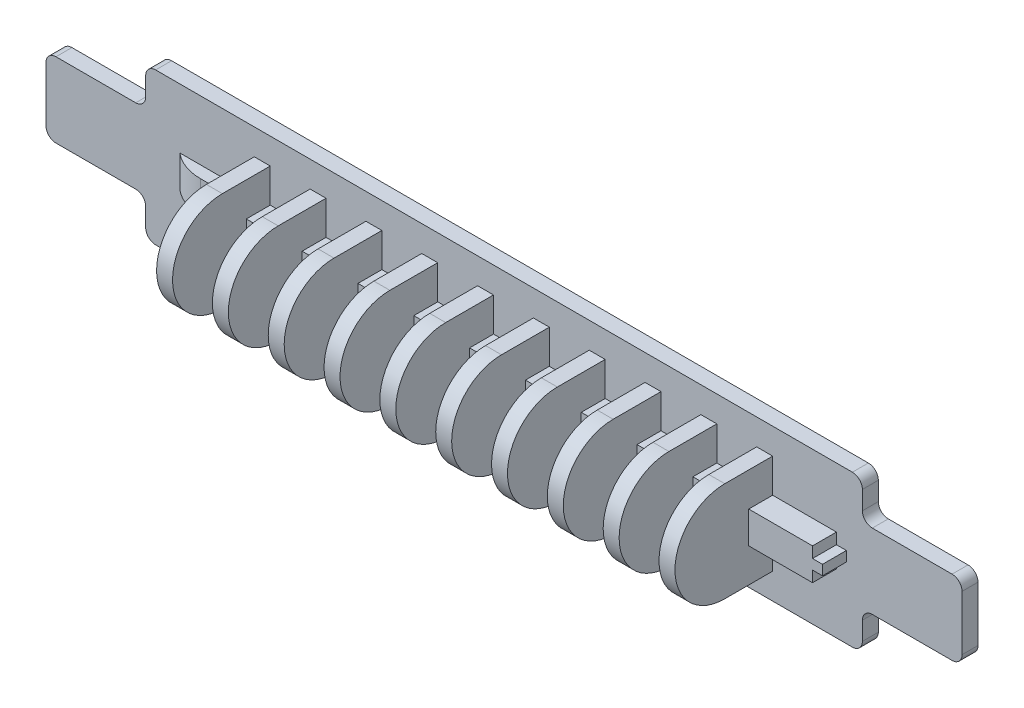
from build123d import *

# Parameters (mm, degrees)
SKETCH_1_W           = 89.86690944
SKETCH_1_H           = 19
EXTRUDE_1_DEPTH      = 2
SKETCH_2_W           = 2
SKETCH_2_H           = 12.5
EXTRUDE_2_DEPTH      = 6
EXTRUDE_3_DEPTH      = 3
SKETCH_4_W           = 2
SKETCH_4_H           = 6.25
REVOLVE_1_ANGLE      = 180
EXTRUDE_8_DEPTH      = 1.5
EXTRUDE_8_DEPTH_BACK = 3.5
SKETCH_11_W          = 9.25
SKETCH_11_H          = 3
SCALE_1_SCALE        = 1.6
CUT_EXTRUDE_START    = -2.4
SKETCH_13_W          = 14.8
SKETCH_13_H          = 4.8
CUT_EXTRUDE_3_DEPTH  = 2.4
SKETCH_16_W          = 2
SKETCH_16_H          = 2.2
CUT_EXTRUDE_5_DEPTH  = 4.8
EXTRUDE_START        = -3.190039
EXTRUDE_10_DEPTH     = 6.4
CUT_EXTRUDE_6_REACH  = 79.611
FILLET_1_R           = 2
SKETCH_19_W          = 20
SKETCH_19_H          = 15
EXTRUDE_11_DEPTH     = 3.2
FILLET_2_R           = 2


with BuildPart() as part:
    # 草图1 → 凸台-拉伸1 (new body)
    with BuildSketch(Plane.XY):
        Rectangle(SKETCH_1_W, SKETCH_1_H)
    extrude(amount=EXTRUDE_1_DEPTH)

    # 草图2 → 凸台-拉伸2 (add)
    with BuildSketch(Plane.XY.offset(2)):
        with Locations((32.68345472, 0)):
            Rectangle(SKETCH_2_W, SKETCH_2_H)
        with Locations((25.68345472, 0)):
            Rectangle(SKETCH_2_W, SKETCH_2_H)
        with Locations((18.68345472, 0)):
            Rectangle(SKETCH_2_W, SKETCH_2_H)
        with Locations((11.68345472, 0)):
            Rectangle(SKETCH_2_W, SKETCH_2_H)
        with Locations((4.68345472, 0)):
            Rectangle(SKETCH_2_W, SKETCH_2_H)
        with Locations((-2.31654528, 0)):
            Rectangle(SKETCH_2_W, SKETCH_2_H)
        with Locations((-9.31654528, 0)):
            Rectangle(SKETCH_2_W, SKETCH_2_H)
        with Locations((-16.31654528, 0)):
            Rectangle(SKETCH_2_W, SKETCH_2_H)
        with Locations((-23.31654528, 0)):
            Rectangle(SKETCH_2_W, SKETCH_2_H)
        with Locations((-30.31654528, 0)):
            Rectangle(SKETCH_2_W, SKETCH_2_H)
    extrude(amount=EXTRUDE_2_DEPTH)

    # 草图3 → 凸台-拉伸3 (add)
    with BuildSketch(Plane.XY.offset(2)):
        Polygon((-29.31654528, -2), (42.93345472, -2), (42.93345472, 2), (-36.31654528, 2), (-36.31654528, -2), align=None)
    extrude(amount=EXTRUDE_3_DEPTH)

    # 草图4 → 旋转1 (revolve)
    with BuildSketch(Plane.XY.offset(8)):
        with Locations((25.68345472, -3.125)):
            Rectangle(SKETCH_4_W, SKETCH_4_H)
        with Locations((32.68345472, -3.125)):
            Rectangle(SKETCH_4_W, SKETCH_4_H)
        with Locations((18.68345472, -3.125)):
            Rectangle(SKETCH_4_W, SKETCH_4_H)
        with Locations((11.68345472, -3.125)):
            Rectangle(SKETCH_4_W, SKETCH_4_H)
        with Locations((4.68345472, -3.125)):
            Rectangle(SKETCH_4_W, SKETCH_4_H)
        with Locations((-2.31654528, -3.125)):
            Rectangle(SKETCH_4_W, SKETCH_4_H)
        with Locations((-9.31654528, -3.125)):
            Rectangle(SKETCH_4_W, SKETCH_4_H)
        with Locations((-16.31654528, -3.125)):
            Rectangle(SKETCH_4_W, SKETCH_4_H)
        with Locations((-23.31654528, -3.125)):
            Rectangle(SKETCH_4_W, SKETCH_4_H)
        with Locations((-30.31654528, -3.125)):
            Rectangle(SKETCH_4_W, SKETCH_4_H)
    revolve(axis=Axis((-31.31654528, 0, 8), (-1, 0, 0)), revolution_arc=REVOLVE_1_ANGLE)

    # 草图11 → 凸台-拉伸8 (add, two sides: drawn at the far end of the back side and taken through both)
    with BuildSketch(Plane.XZ.offset(2).offset(-EXTRUDE_8_DEPTH_BACK)):
        with Locations((38.30845472, 3.5)):
            Rectangle(SKETCH_11_W, SKETCH_11_H)
    extrude(amount=EXTRUDE_8_DEPTH + EXTRUDE_8_DEPTH_BACK)


with BuildPart() as part_1:
    # 缩放比例1: scaled about (1.114528854, -0.016602301, 3.861170743)
    add(part.part.scale(SCALE_1_SCALE).moved(Location((-0.668717312, 0.009961381, -2.316702446))))

    # 草图13 → 切除-拉伸3 (cut)
    with BuildSketch(Plane.XZ.offset(5.59003862).offset(CUT_EXTRUDE_START)):
        with Locations((60.62481024, 3.283297554)):
            Rectangle(SKETCH_13_W, SKETCH_13_H)
    extrude(amount=CUT_EXTRUDE_3_DEPTH, mode=Mode.SUBTRACT)

    # 草图16 → 切除-拉伸5 (cut)
    with BuildSketch(Plane.XY.offset(5.683297554)):
        with Locations((67.02481024, -2.09003862)):
            Rectangle(SKETCH_16_W, SKETCH_16_H)
        with Locations((67.02481024, 2.10996138)):
            Rectangle(SKETCH_16_W, SKETCH_16_H)
    extrude(amount=-CUT_EXTRUDE_5_DEPTH, mode=Mode.SUBTRACT)

    # 草图17 → 凸台-拉伸10 (add)
    with BuildSketch(Plane(origin=(0, 0, 0), x_dir=(1, 0, 0), z_dir=(0, 1, 0)).offset(EXTRUDE_START)):
        with BuildLine():
            Line((-58.77518976, -5.683297554), (-58.77518976, -0.883297554))
            Line((-58.77518976, -0.883297554), (-67.445131169, -0.883297554))
            ThreePointArc((-67.445131169, -0.883297554), (-63.730184312, -4.40320806), (-58.77518976, -5.683297554))
        make_face()
    extrude(amount=EXTRUDE_10_DEPTH)

    # 草图18 → 切除-拉伸6 (cut, up to next)
    with BuildSketch(Plane(origin=(0, 3.20996138, 0), x_dir=(1, 0, 0), z_dir=(0, 1, 0)), mode=Mode.PRIVATE) as cut_extrude_6_sk1:
        with BuildLine():
            Line((-50.77518976, -3.283297554), (-59.153474578, -3.283297554))
            ThreePointArc((-59.153474578, -3.283297554), (-62.646552572, -2.664466304), (-65.714448246, -0.883297554))
            Line((-65.714448246, -0.883297554), (-67.445131169, -0.883297554))
            ThreePointArc((-67.445131169, -0.883297554), (-63.730184312, -4.40320806), (-58.77518976, -5.683297554))
            Line((-58.77518976, -5.683297554), (-50.77518976, -5.683297554))
            Line((-50.77518976, -5.683297554), (-50.77518976, -3.283297554))
        make_face()
    cut_extrude_6_tool1 = extrude(cut_extrude_6_sk1.sketch, amount=-CUT_EXTRUDE_6_REACH, mode=Mode.PRIVATE) & part_1.part
    add(cut_extrude_6_tool1.solids().sort_by_distance((-58.541843, 3.209961, 4.008165))[0], mode=Mode.SUBTRACT)

    # 圆角1
    fillet_1_edges = [part_1.edges().sort_by_distance(p)[0] for p in [
        (71.22481024, -15.190038619, -0.716702446),
        (-72.562244864, -15.190038619, -0.716702446),
        (-72.562244864, 15.209961381, -0.716702446),
        (71.22481024, 15.209961381, -0.716702446),
    ]]
    fillet(fillet_1_edges, radius=FILLET_1_R)

    # 草图19 → 凸台-拉伸11 (add)
    with BuildSketch(Plane(origin=(0, 0, -2.316702446), x_dir=(-1, 0, 0), z_dir=(0, 0, -1))):
        with Locations((-81.22481024, 0)):
            Rectangle(SKETCH_19_W, SKETCH_19_H)
        with Locations((82.562244864, 0)):
            Rectangle(SKETCH_19_W, SKETCH_19_H)
    extrude(amount=-EXTRUDE_11_DEPTH)

    # 圆角2
    fillet_2_edges = [part_1.edges().sort_by_distance(p)[0] for p in [
        (91.22481024, 7.5, -0.716702446),
        (91.22481024, -7.5, -0.716702446),
        (71.22481024, -7.5, -0.716702446),
        (71.22481024, 7.5, -0.716702446),
        (-92.562244864, -7.5, -0.716702446),
        (-92.562244864, 7.5, -0.716702446),
        (-72.562244864, 7.5, -0.716702446),
        (-72.562244864, -7.5, -0.716702446),
    ]]
    fillet(fillet_2_edges, radius=FILLET_2_R)


solid = part_1.part
